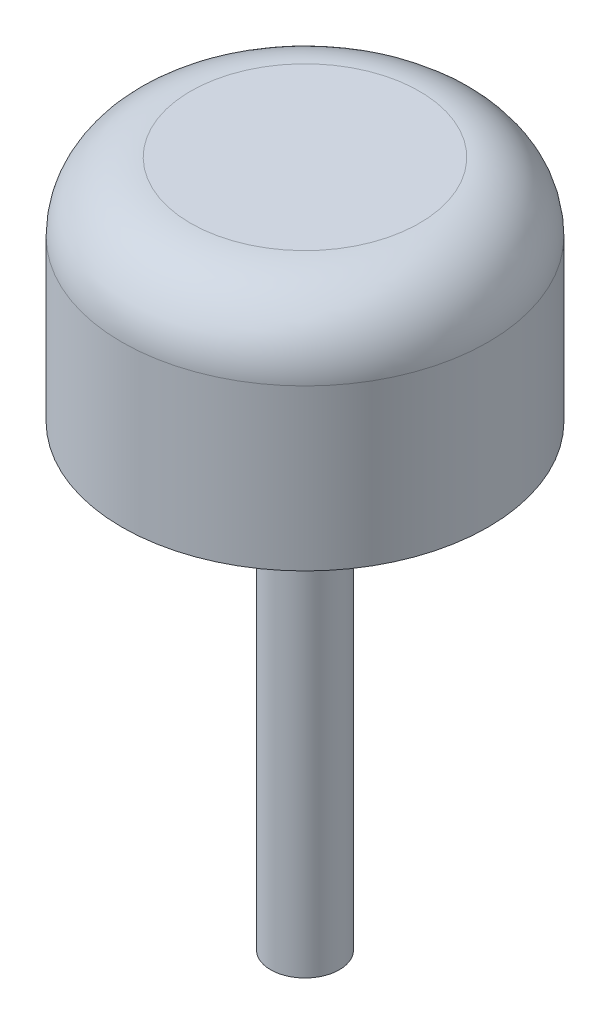
from build123d import *

# Parameters (mm, degrees)
SKETCH_1_R      = 8
EXTRUDE_1_DEPTH = 10
SKETCH_2_R      = 1.5
EXTRUDE_2_DEPTH = 20
FILLET_2_R      = 3


with BuildPart() as part:
    # 草图1 → 凸台-拉伸1 (new body)
    with BuildSketch(Plane(origin=(0, 0, 0), x_dir=(1, 0, 0), z_dir=(0, 1, 0))):
        with Locations(Location((0, 0, 0), (0, 0, 270))):
            Circle(SKETCH_1_R)
    extrude(amount=EXTRUDE_1_DEPTH)

    # 草图2 → 凸台-拉伸2 (add)
    with BuildSketch(Plane.XZ):
        with Locations(Location((0, 0, 0), (0, 0, 90))):
            Circle(SKETCH_2_R)
    extrude(amount=EXTRUDE_2_DEPTH)

    # 圆角2
    fillet_2_edges = [part.edges().sort_by_distance(p)[0] for p in [
        (0, 10, -8),
    ]]
    fillet(fillet_2_edges, radius=FILLET_2_R)


solid = part.part
